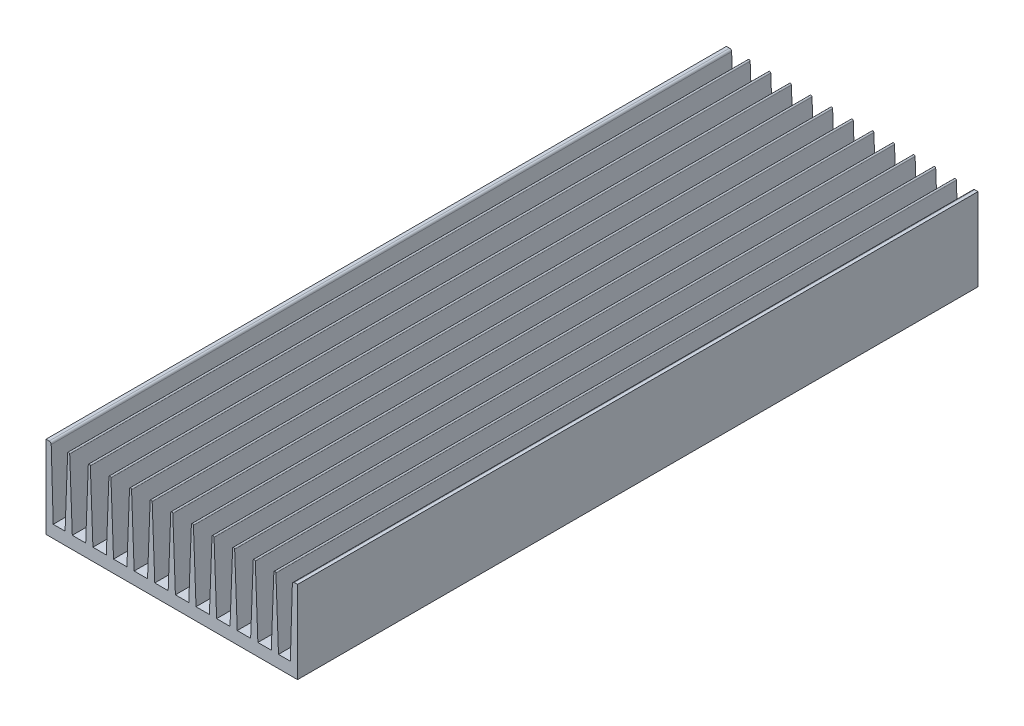
from build123d import *

# Parameters (mm, degrees)
EXTRUDE_1_DEPTH       = 330
EXTRUDE_3_DEPTH       = 330
PATTERN_CURVE_1_COUNT = 11
PATTERN_CURVE_1_PITCH = 10
SKETCH_3_R            = 2.25
CUT_EXTRUDE_1_DEPTH   = 6
SKETCH_4_R            = 1.6
CUT_EXTRUDE_2_DEPTH   = 6


with BuildPart() as part:
    # Эскиз1 → Вытянуть1 (new body)
    with BuildSketch(Plane.XY):
        with BuildLine():
            Line((0, 40), (1.528979332, 40))
            ThreePointArc((1.528979332, 40), (2.225614441, 39.717425624), (2.528547087, 39.029399052))
            Line((2.528547087, 39.029399052), (3.5, 6))
            Line((3.5, 6), (118.5, 6))
            Line((118.5, 6), (119.471452913, 39.029399052))
            ThreePointArc((119.471452913, 39.029399052), (119.774385559, 39.717425624), (120.471020668, 40))
            Line((120.471020668, 40), (122, 40))
            Line((122, 40), (122, 0))
            Line((122, 0), (0, 0))
            Line((0, 0), (0, 40))
        make_face()
    extrude(amount=EXTRUDE_1_DEPTH)

    # Эскиз2 → Вытянуть3 (add)
    with BuildSketch(Plane.XY.offset(330)):
        with BuildLine():
            Line((10.5, 39.5), (9.25, 6))
            Line((9.25, 6), (12.75, 6))
            Line((12.75, 6), (11.5, 39.5))
            ThreePointArc((11.5, 39.5), (11, 40), (10.5, 39.5))
        make_face()
    extrude_3 = extrude(amount=-EXTRUDE_3_DEPTH)

    # Кривая1: Вытянуть3 ×11
    with Locations(*[(i * PATTERN_CURVE_1_PITCH, 0, 0) for i in range(1, PATTERN_CURVE_1_COUNT)]):
        add(extrude_3)

    # Эскиз3 → Вырез-Вытянуть1 (cut)
    with BuildSketch(Plane.XZ):
        with Locations((26, 322)):
            Circle(SKETCH_3_R)
        with Locations((96, 322)):
            Circle(SKETCH_3_R)
        with Locations(Location((96, 8, 0), (0, 0, 180))):
            Circle(SKETCH_3_R)
        with Locations(Location((26, 8, 0), (0, 0, 180))):
            Circle(SKETCH_3_R)
    extrude(amount=-CUT_EXTRUDE_1_DEPTH, mode=Mode.SUBTRACT)

    # Эскиз4 → Вырез-Вытянуть2 (cut)
    with BuildSketch(Plane(origin=(147.933613103, 0, 237.946321054), x_dir=(-1, 0, 0), z_dir=(0, -1, 0))):
        with Locations(Location((80.933613103, -68.053678946, 0), (0, 0, 180))):
            Circle(SKETCH_4_R)
        with Locations(Location((42.433613103, 124.346321054, 0), (0, 0, 180))):
            Circle(SKETCH_4_R)
        with Locations(Location((85.933613103, 211.946321054, 0), (0, 0, 180))):
            Circle(SKETCH_4_R)
        with Locations(Location((85.933613103, 76.946321054, 0), (0, 0, 180))):
            Circle(SKETCH_4_R)
        with Locations(Location((80.933613103, 61.946321054, 0), (0, 0, 180))):
            Circle(SKETCH_4_R)
        with Locations(Location((118.933613103, 46.446321054, 0), (0, 0, 180))):
            Circle(SKETCH_4_R)
    extrude(amount=-CUT_EXTRUDE_2_DEPTH, mode=Mode.SUBTRACT)


solid = part.part
